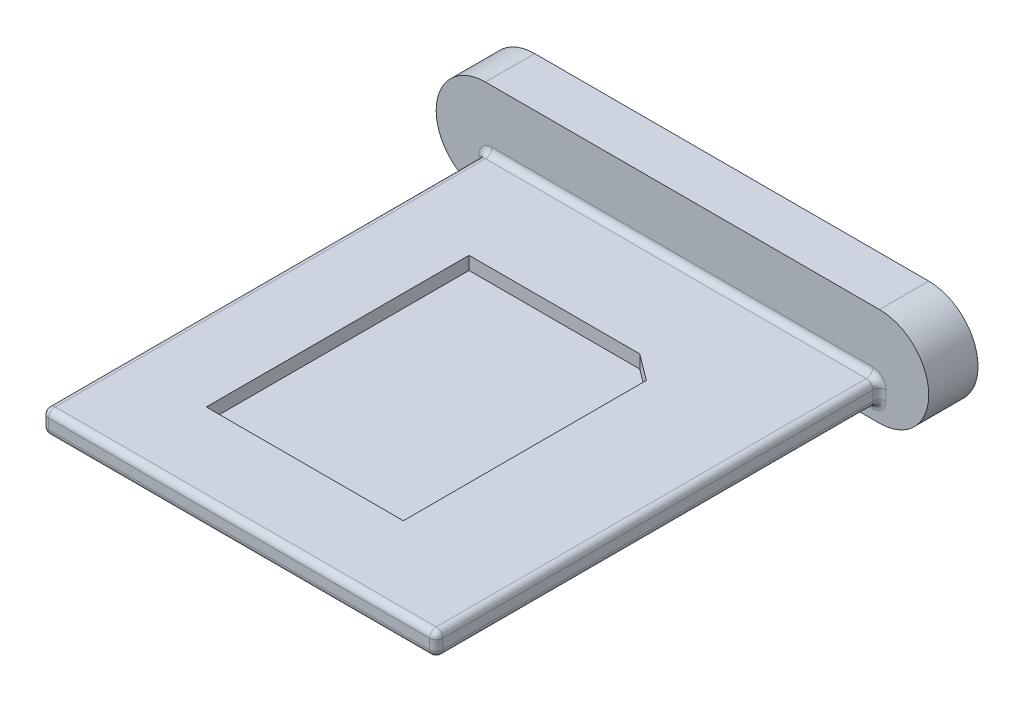
from build123d import *

# Parameters (mm, degrees)
EXTRUDE_3_DEPTH     = 1.5
EXTRUDE_4_DEPTH     = 13.5
CUT_EXTRUDE_2_DEPTH = 0.4
FILLET_2_R          = 0.2
CUT_EXTRUDE_3_DEPTH = 0.4


with BuildPart() as part:
    # 草图1 → 凸台-拉伸3 (new body)
    with BuildSketch(Plane.XY):
        with BuildLine():
            Line((-5.371727749, 2.046879183), (6.628272251, 2.046879183))
            ThreePointArc((6.628272251, 2.046879183), (8.128272251, 0.546879183), (6.628272251, -0.953120817))
            Line((6.628272251, -0.953120817), (-5.371727749, -0.953120817))
            ThreePointArc((-5.371727749, -0.953120817), (-6.871727749, 0.546879183), (-5.371727749, 2.046879183))
        make_face()
    extrude(amount=EXTRUDE_3_DEPTH)

    # 草图2 → 凸台-拉伸4 (add)
    with BuildSketch(Plane.XY.offset(1.5)):
        Polygon((-5.371727749, -0.07294571), (-5.371727749, 0.22705429), (6.628272251, 0.22705429), (6.628272251, -0.07294571), (6.628272251, -0.47294571), (-5.371727749, -0.47294571), align=None)
    extrude(amount=EXTRUDE_4_DEPTH)

    # 草图3 → 切除-拉伸2 (cut)
    with BuildSketch(Plane(origin=(0, 0.22705429, 0), x_dir=(1, 0, 0), z_dir=(0, 1, 0))):
        Polygon((-2.871727749, -4.5), (-2.871727749, -12.5), (3.128272251, -12.5), (3.128272251, -5.1), (1.784565104, -4.5), align=None)
    extrude(amount=-CUT_EXTRUDE_2_DEPTH, mode=Mode.SUBTRACT)

    # 圆角2
    fillet_2_edges = [part.edges().sort_by_distance(p)[0] for p in [
        (0.628272251, 0.22705429, 1.5),
        (6.628272251, 0.22705429, 8.25),
        (-5.371727749, -0.12294571, 1.5),
        (-5.371727749, 0.22705429, 8.25),
        (0.628272251, -0.47294571, 1.5),
        (-5.371727749, -0.47294571, 8.25),
        (6.628272251, -0.12294571, 1.5),
        (6.628272251, -0.47294571, 8.25),
        (6.628272251, -0.12294571, 15),
        (0.628272251, 0.22705429, 15),
        (-5.371727749, -0.12294571, 15),
        (0.628272251, -0.47294571, 15),
    ]]
    fillet(fillet_2_edges, radius=FILLET_2_R)

    # 草图4 → 切除-拉伸3 (cut)
    with BuildSketch(Plane(origin=(0, 0.22705429, 0), x_dir=(1, 0, 0), z_dir=(0, 1, 0))):
        Polygon((-2.871727749, -12.5), (-2.871727749, -4.5), (2.328272251, -4.5), (3.128272251, -5.1), (3.128272251, -12.5), align=None)
    extrude(amount=-CUT_EXTRUDE_3_DEPTH, mode=Mode.SUBTRACT)


solid = part.part
